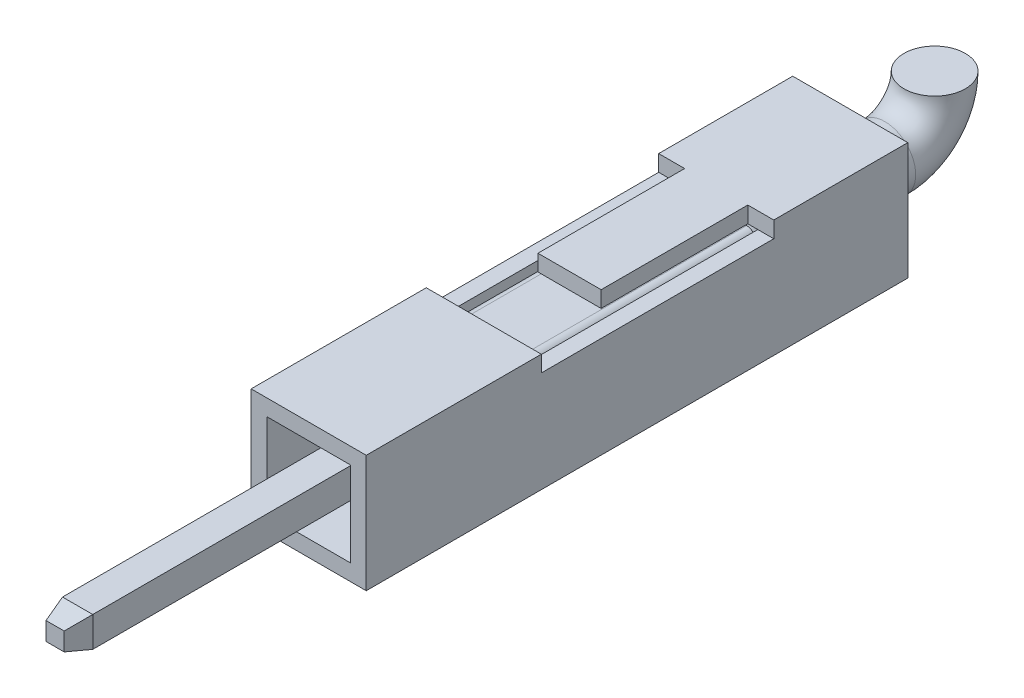
from build123d import *
from OCP.BRepFilletAPI import BRepFilletAPI_MakeChamfer

# Parameters (mm, degrees)
SKETCH1_W           = 2.55
SKETCH1_H           = 2.6
SKETCH1_W_2         = 0.99
SKETCH1_H_2         = 1.04
BOSS_EXTRUDE1_DEPTH = 12
CUT_EXTRUDE1_REACH  = 14.337
SKETCH2_W           = 5.15
SKETCH2_H           = 0.36
SKETCH3_W           = 1.843846154
SKETCH3_H           = 1.88
CUT_EXTRUDE2_DEPTH  = 12
SKETCH4_W           = 1.4
SKETCH4_H           = 3.25
BOSS_EXTRUDE2_DEPTH = 0.36
SKETCH5_W           = 1.750648116
SKETCH5_H           = 1.78497455
SKETCH5_W_2         = 1.550648116
SKETCH5_H_2         = 1.58497455
BOSS_EXTRUDE3_DEPTH = 5.15
FILLET1_R           = 0.2
FILLET2_R           = 0.2
SKETCH7_R           = 0.68
SKETCH8_W           = 0.67
SKETCH8_H           = 0.67
BOSS_EXTRUDE4_DEPTH = 9.5
CHAMFER1_SIZE       = 0.5
CHAMFER1_SIZE2      = 0.133974596


with BuildPart() as part:
    # Sketch1 → Boss-Extrude1 (new body)
    with BuildSketch(Plane.XY):
        Rectangle(SKETCH1_W, SKETCH1_H)
        Rectangle(SKETCH1_W_2, SKETCH1_H_2, mode=Mode.SUBTRACT)
    extrude(amount=BOSS_EXTRUDE1_DEPTH)

    # Sketch2 → Cut-Extrude1 (cut, up to next)
    with BuildSketch(Plane.ZY.offset(1.275), mode=Mode.PRIVATE) as cut_extrude1_sk1:
        with Locations((5.545, 1.12)):
            Rectangle(SKETCH2_W, SKETCH2_H)
    cut_extrude1_tool1 = extrude(cut_extrude1_sk1.sketch, amount=-CUT_EXTRUDE1_REACH, mode=Mode.PRIVATE) & part.part
    add(cut_extrude1_tool1.solids().sort_by_distance((-1.275, 1.12, 5.545))[0], mode=Mode.SUBTRACT)

    # Sketch3 → Cut-Extrude2 (cut)
    with BuildSketch(Plane(origin=(0, 0, 0), x_dir=(-1, 0, 0), z_dir=(0, 0, -1))):
        Rectangle(SKETCH3_W, SKETCH3_H)
    extrude(amount=-CUT_EXTRUDE2_DEPTH, mode=Mode.SUBTRACT)

    # Sketch4 → Boss-Extrude2 (add)
    with BuildSketch(Plane(origin=(0, 1.3, 0), x_dir=(1, 0, 0), z_dir=(0, 1, 0))):
        with Locations((0, -4.595)):
            Rectangle(SKETCH4_W, SKETCH4_H)
    extrude(amount=-BOSS_EXTRUDE2_DEPTH)


with BuildPart() as body_2:
    # Sketch5 → Boss-Extrude3 (new body)
    with BuildSketch(Plane(origin=(0, 0, 8.12), x_dir=(-1, 0, 0), z_dir=(0, 0, -1))):
        Rectangle(SKETCH5_W, SKETCH5_H)
        Rectangle(SKETCH5_W_2, SKETCH5_H_2, mode=Mode.SUBTRACT)
    extrude(amount=BOSS_EXTRUDE3_DEPTH)

    # Fillet1
    fillet1_edges = [body_2.edges().sort_by_distance(p)[0] for p in [
        (-0.775324058, 0.792487275, 5.545),
        (0.775324058, 0.792487275, 5.545),
        (-0.775324058, -0.792487275, 5.545),
        (0.775324058, -0.792487275, 5.545),
    ]]
    fillet(fillet1_edges, radius=FILLET1_R)

    # Fillet2
    fillet2_edges = [body_2.edges().sort_by_distance(p)[0] for p in [
        (0.875324058, 0.892487275, 5.545),
        (-0.875324058, 0.892487275, 5.545),
        (-0.875324058, -0.892487275, 5.545),
        (0.875324058, -0.892487275, 5.545),
    ]]
    fillet(fillet2_edges, radius=FILLET2_R)


with BuildPart() as body_3:
    # Sweep2: sweep along a path in Sketch6
    with BuildLine(Plane(origin=(0, 0, 0), x_dir=(0, 0, -1), z_dir=(1, 0, 0))) as sweep2_path:
        Line((-2.97, 0), (0.769827469, 0))
        ThreePointArc((0.769827469, 0), (1.547766926, 0.322233074), (1.87, 1.100172531))
    # Sketch7 → Sweep2 (sweep)
    with BuildSketch(Plane(origin=(0, 0, 2.97), x_dir=(-1, 0, 0), z_dir=(0, 0, -1))):
        Circle(SKETCH7_R)
    sweep(path=sweep2_path.line)


with BuildPart() as body_4:
    # Sketch8 → Boss-Extrude4 (new body)
    with BuildSketch(Plane.XY.offset(8.12)):
        Rectangle(SKETCH8_W, SKETCH8_H)
    extrude(amount=BOSS_EXTRUDE4_DEPTH)

    # Chamfer1: one chamfer whose edges measure the first distance from different faces: ONE call of the kernel's chamfer builder (chamfer() names one face for all edges)
    chamfer1_edges_1 = [body_4.edges().sort_by_distance(p)[0] for p in [
        (0, -0.335, 17.62),
    ]]
    chamfer1_side_1 = [body_4.faces().sort_by_distance(p)[0] for p in [
        (0, -0.335, 12.87),
    ]]
    chamfer1_edges_2 = [body_4.edges().sort_by_distance(p)[0] for p in [
        (0.335, 0, 17.62),
    ]]
    chamfer1_side_2 = [body_4.faces().sort_by_distance(p)[0] for p in [
        (0.335, 0, 12.87),
    ]]
    chamfer1_edges_3 = [body_4.edges().sort_by_distance(p)[0] for p in [
        (0, 0.335, 17.62),
    ]]
    chamfer1_side_3 = [body_4.faces().sort_by_distance(p)[0] for p in [
        (0, 0.335, 12.87),
    ]]
    chamfer1_edges_4 = [body_4.edges().sort_by_distance(p)[0] for p in [
        (-0.335, 0, 17.62),
    ]]
    chamfer1_side_4 = [body_4.faces().sort_by_distance(p)[0] for p in [
        (-0.335, 0, 12.87),
    ]]
    chamfer1 = BRepFilletAPI_MakeChamfer(body_4.part.solid().wrapped)
    for e in chamfer1_edges_1:
        chamfer1.Add(CHAMFER1_SIZE, CHAMFER1_SIZE2, e.wrapped, chamfer1_side_1[0].wrapped)  # the first distance lies on this face
    for e in chamfer1_edges_2:
        chamfer1.Add(CHAMFER1_SIZE, CHAMFER1_SIZE2, e.wrapped, chamfer1_side_2[0].wrapped)  # the first distance lies on this face
    for e in chamfer1_edges_3:
        chamfer1.Add(CHAMFER1_SIZE, CHAMFER1_SIZE2, e.wrapped, chamfer1_side_3[0].wrapped)  # the first distance lies on this face
    for e in chamfer1_edges_4:
        chamfer1.Add(CHAMFER1_SIZE, CHAMFER1_SIZE2, e.wrapped, chamfer1_side_4[0].wrapped)  # the first distance lies on this face
    add(Compound.cast(chamfer1.Shape()), mode=Mode.REPLACE)


solid = Compound([part.part, body_2.part, body_3.part, body_4.part])
